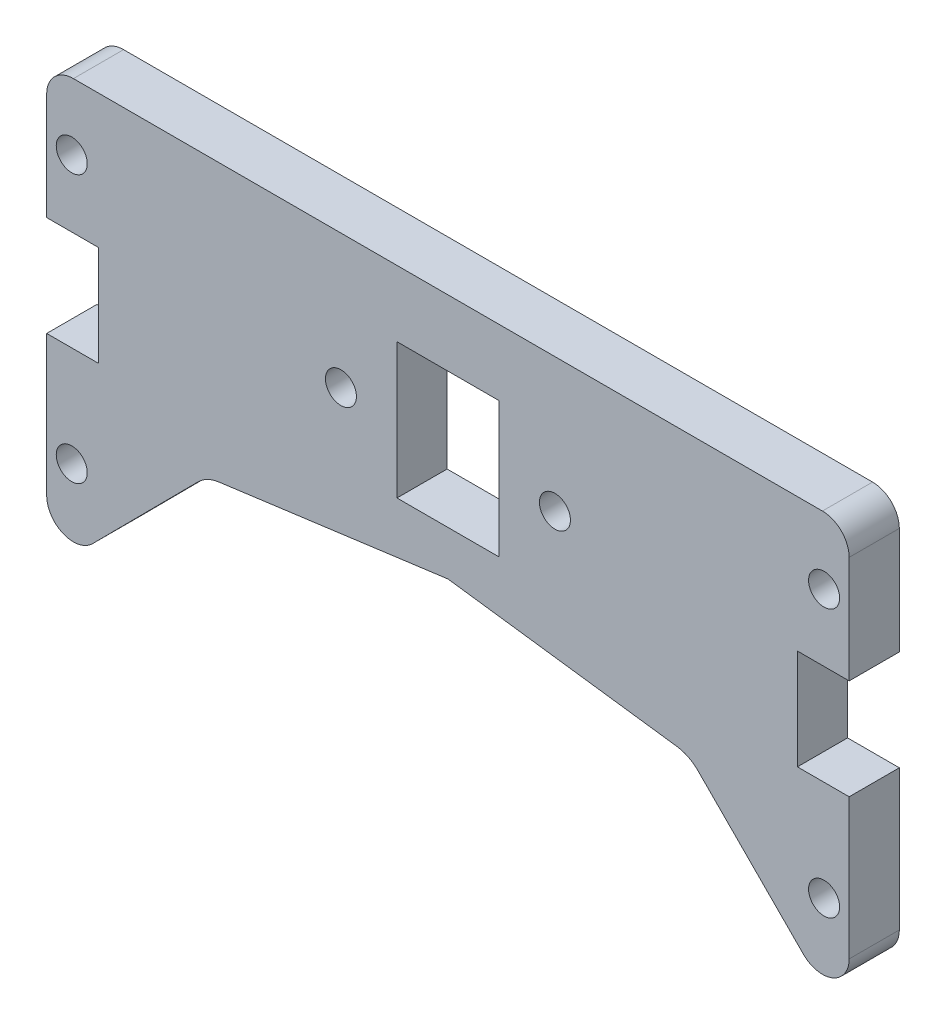
from build123d import *

# Parameters (mm, degrees)
SKETCH2_R           = 1.4732
SKETCH2_W           = 9.6774
SKETCH2_H           = 12.8524
BOSS_EXTRUDE1_DEPTH = 4.7625


with BuildPart() as part:
    # Sketch2 → Boss-Extrude1 (new body)
    with BuildSketch(Plane.XY):
        with BuildLine():
            Line((-38.1, -16.51), (-38.1, -3.175))
            Line((-38.1, -3.175), (-33.1851, -3.175))
            Line((-33.1851, -3.175), (-33.1851, 6.35))
            Line((-33.1851, 6.35), (-38.1, 6.35))
            Line((-38.1, 6.35), (-38.1, 16.51))
            ThreePointArc((-38.1, 16.51), (-37.356051224, 18.306051224), (-35.56, 19.05))
            Line((-35.56, 19.05), (35.56, 19.05))
            ThreePointArc((35.56, 19.05), (37.356051224, 18.306051224), (38.1, 16.51))
            Line((38.1, 16.51), (38.1, 6.35))
            Line((38.1, 6.35), (33.1851, 6.35))
            Line((33.1851, 6.35), (33.1851, -3.175))
            Line((33.1851, -3.175), (38.1, -3.175))
            Line((38.1, -3.175), (38.1, -16.51))
            ThreePointArc((38.1, -16.51), (36.527699334, -18.858437353), (33.757355906, -18.299434064))
            Line((33.757355906, -18.299434064), (23.740904814, -8.209039139))
            ThreePointArc((23.740904814, -8.209039139), (22.825089709, -7.548328204), (21.745183011, -7.218089243))
            Line((21.745183011, -7.218089243), (0, -4.31608303))
            Line((0, -4.31608303), (-21.745183011, -7.218089243))
            ThreePointArc((-21.745183011, -7.218089243), (-22.825089709, -7.548328204), (-23.740904814, -8.209039139))
            Line((-23.740904814, -8.209039139), (-33.757355906, -18.299434064))
            ThreePointArc((-33.757355906, -18.299434064), (-36.527699334, -18.858437353), (-38.1, -16.51))
        make_face()
        with Locations(Location((-35.71875, 12.7, 0), (0, 0, 180))):
            Circle(SKETCH2_R, mode=Mode.SUBTRACT)
        with Locations(Location((-35.71875, -12.7, 0), (0, 0, 180))):
            Circle(SKETCH2_R, mode=Mode.SUBTRACT)
        with Locations(Location((35.71875, -12.7, 0), (0, 0, 180))):
            Circle(SKETCH2_R, mode=Mode.SUBTRACT)
        with Locations(Location((35.71875, 12.7, 0), (0, 0, 180))):
            Circle(SKETCH2_R, mode=Mode.SUBTRACT)
        with Locations(Location((-10.16, 6.335014615, 0), (0, 0, 180))):
            Circle(SKETCH2_R, mode=Mode.SUBTRACT)
        with Locations(Location((10.16, 6.335014615, 0), (0, 0, 180))):
            Circle(SKETCH2_R, mode=Mode.SUBTRACT)
        with Locations((0, 6.35)):
            Rectangle(SKETCH2_W, SKETCH2_H, mode=Mode.SUBTRACT)
    extrude(amount=BOSS_EXTRUDE1_DEPTH)


solid = part.part
